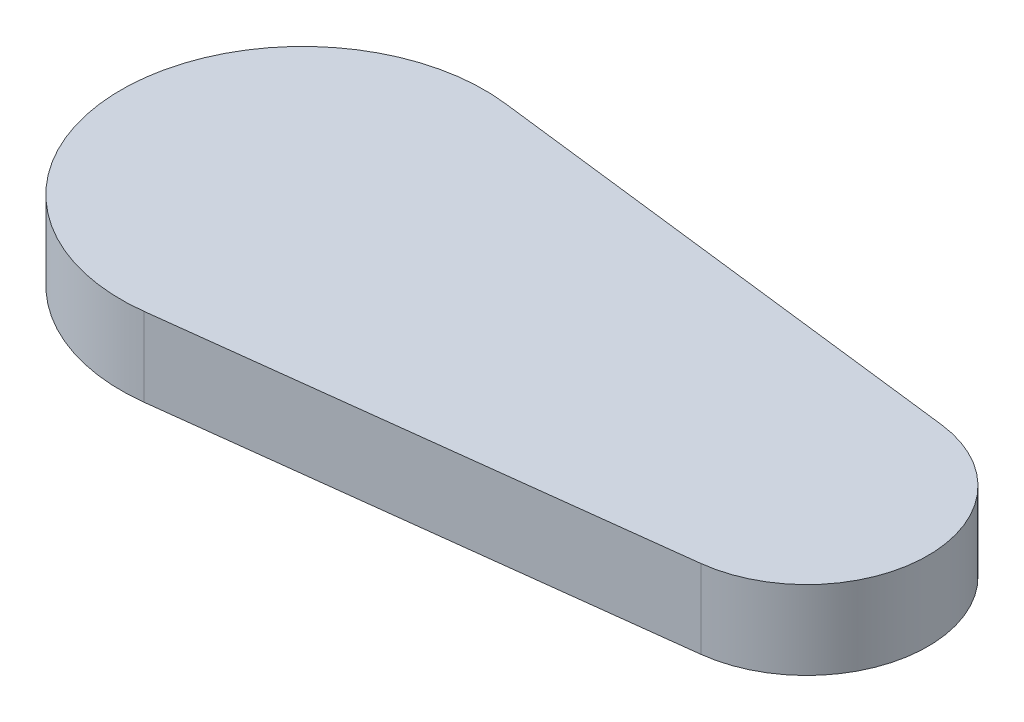
from build123d import *

# Parameters (mm, degrees)
SKETCH1_R           = 6
SKETCH1_R_2         = 4
BOSS_EXTRUDE1_DEPTH = 2.6


with BuildPart() as part:
    # Sketch1 → Boss-Extrude1 (new body)
    with BuildSketch(Plane(origin=(0, 0, 0), x_dir=(1, 0, 0), z_dir=(0, 1, 0))):
        Circle(SKETCH1_R)
        with Locations((16.65, 0)):
            Circle(SKETCH1_R_2)
        with BuildLine():
            Line((17.13048048, 3.97103746), (0.720720721, 5.95655619))
            ThreePointArc((0.720720721, 5.95655619), (4.490229634, 3.979678107), (6, 0))
            ThreePointArc((6, 0), (4.490229634, -3.979678107), (0.720720721, -5.95655619))
            Line((0.720720721, -5.95655619), (17.13048048, -3.97103746))
            ThreePointArc((17.13048048, -3.97103746), (12.65, 0), (17.13048048, 3.97103746))
        make_face()
    extrude(amount=BOSS_EXTRUDE1_DEPTH)


solid = part.part
